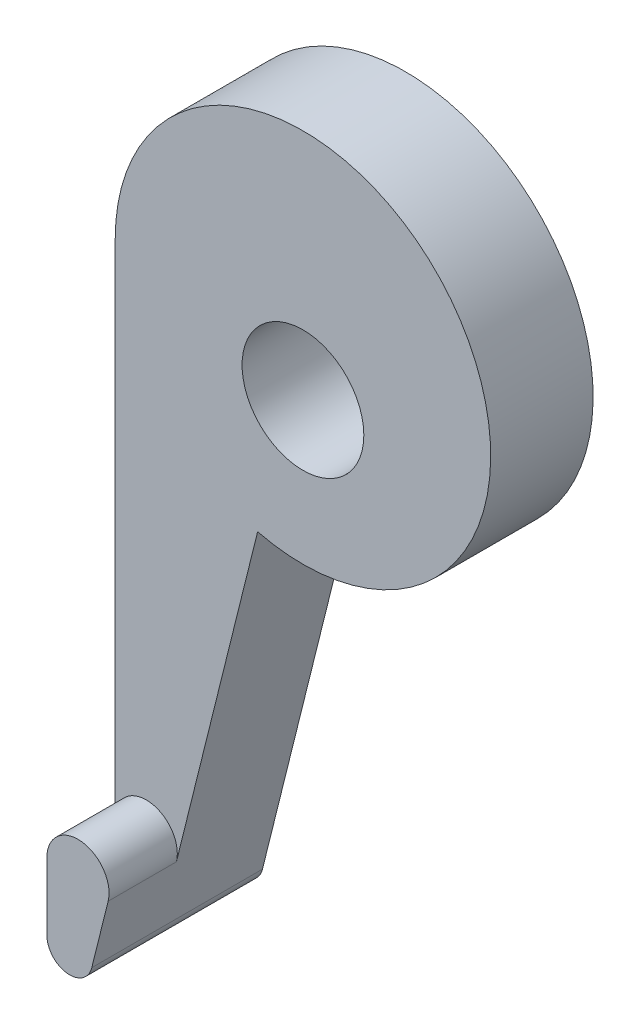
from build123d import *

# Parameters (mm, degrees)
SKETCH1_R           = 2.675
BOSS_EXTRUDE1_DEPTH = 4.5
BOSS_EXTRUDE2_DEPTH = 3


with BuildPart() as part:
    # Sketch1 → Boss-Extrude1 (new body)
    with BuildSketch(Plane.XY):
        with BuildLine():
            Line((1.335499014, 8.518725494), (1.335499014, -16.481274506))
            ThreePointArc((1.335499014, -16.481274506), (2.213885401, -17.473852024), (3.305919272, -16.722696381))
            Line((3.305919272, -16.722696381), (7.593768545, 0.512758361))
            ThreePointArc((7.593768545, 0.512758361), (16.08527887, 13.599607486), (1.335499014, 8.518725494))
        make_face()
        with Locations((9.585499014, 6.518725494)):
            Circle(SKETCH1_R, mode=Mode.SUBTRACT)
    extrude(amount=BOSS_EXTRUDE1_DEPTH)

    # Sketch2 → Boss-Extrude2 (add)
    with BuildSketch(Plane.XY.offset(4.5)):
        with BuildLine():
            Line((1.335499014, -13.503541952), (1.335499014, -16.481274506))
            ThreePointArc((1.335499014, -16.481274506), (2.213885401, -17.473852024), (3.305919272, -16.722696381))
            Line((3.305919272, -16.722696381), (4.024809049, -13.833044386))
            ThreePointArc((4.024809049, -13.833044386), (2.866323075, -12.148831621), (1.335499014, -13.503541952))
        make_face()
    extrude(amount=BOSS_EXTRUDE2_DEPTH)


solid = part.part
